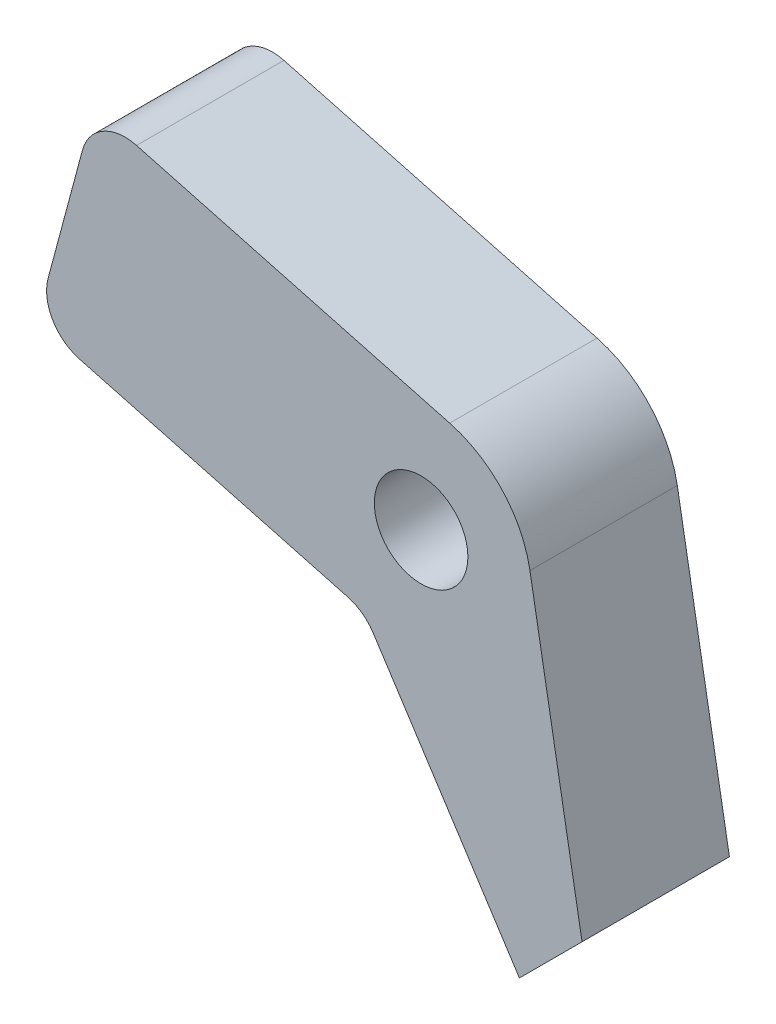
from build123d import *

# Parameters (mm, degrees)
SKETCH1_R           = 3.175
BOSS_EXTRUDE1_DEPTH = 10
FILLET1_R           = 3


with BuildPart() as part:
    # Sketch1 → Boss-Extrude1 (new body)
    with BuildSketch(Plane.XY):
        with BuildLine():
            Line((1.941142838, 7.244443697), (-22.207002819, 13.714919825))
            Line((-22.207002819, 13.714919825), (-26.089288495, -0.77396757))
            Line((-26.089288495, -0.77396757), (-3.871447622, -6.727220089))
            Line((-3.871447622, -6.727220089), (6.671220145, -23))
            Line((6.671220145, -23), (10.921738991, -18.749481154))
            Line((10.921738991, -18.749481154), (7.386058148, 1.302361333))
            ThreePointArc((7.386058148, 1.302361333), (5.529580026, 5.066926557), (1.941142838, 7.244443697))
        make_face()
        Circle(SKETCH1_R, mode=Mode.SUBTRACT)
    extrude(amount=BOSS_EXTRUDE1_DEPTH)

    # Fillet1
    fillet1_edges = [part.edges().sort_by_distance(p)[0] for p in [
        (-3.871447622, -6.727220089, 5),
        (-26.089288495, -0.77396757, 5),
        (-22.207002819, 13.714919825, 5),
    ]]
    fillet(fillet1_edges, radius=FILLET1_R)


solid = part.part
